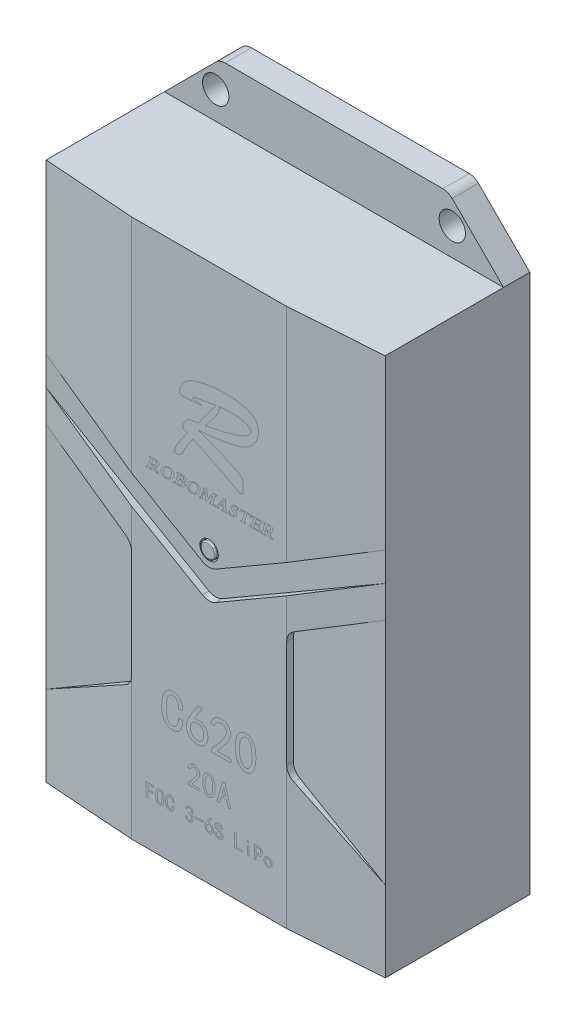
from build123d import *

# Parameters (mm, degrees)
SKETCH_1_W          = 25.8
SKETCH_1_H          = 49.4
EXTRUDE_1_DEPTH     = 11.5
SKETCH_2_W          = 65.082763186
SKETCH_2_H          = 29.72436647
SKETCH_2_W_2        = 74.485765389
SKETCH_2_H_2        = 30.540329471
CUT_EXTRUDE_1_DEPTH = 9.5
SKETCH_3_R          = 1
CUT_EXTRUDE_3_DEPTH = 11.5
CUT_EXTRUDE_4_DEPTH = 11.5
CUT_EXTRUDE_5_DEPTH = 62.5
SKETCH_6_R          = 0.7
CUT_EXTRUDE_6_DEPTH = 1
SKETCH_7_R          = 0.6
EXTRUDE_2_DEPTH     = 1.1
FILLET_1_R          = 0.1
CUT_EXTRUDE_7_DEPTH = 0.5
CUT_EXTRUDE_8_DEPTH = 0.5
FILLET_2_R          = 1
FILLET_3_R          = 1
FILLET_4_R          = 1


with BuildPart() as part:
    # 草图1 → 凸台-拉伸1 (new body)
    with BuildSketch(Plane.XY):
        Rectangle(SKETCH_1_W, SKETCH_1_H)
    extrude(amount=EXTRUDE_1_DEPTH)

    # 草图2 → 切除-拉伸1 (cut)
    with BuildSketch(Plane.XY.offset(11.5)):
        with Locations((5.938113154, 35.362183235)):
            Rectangle(SKETCH_2_W, SKETCH_2_H)
        with Locations((7.608894538, -35.770164736)):
            Rectangle(SKETCH_2_W_2, SKETCH_2_H_2)
    extrude(amount=-CUT_EXTRUDE_1_DEPTH, mode=Mode.SUBTRACT)

    # 草图3 → 切除-拉伸3 (cut)
    with BuildSketch(Plane.XY.offset(11.5)):
        with Locations((9, -22.6)):
            Circle(SKETCH_3_R)
        with Locations((-9, -22.6)):
            Circle(SKETCH_3_R)
        with Locations((-9, 22.6)):
            Circle(SKETCH_3_R)
        with Locations((9, 22.6)):
            Circle(SKETCH_3_R)
    extrude(amount=-CUT_EXTRUDE_3_DEPTH, mode=Mode.SUBTRACT)

    # 草图4 → 切除-拉伸4 (cut)
    with BuildSketch(Plane.XY.offset(2)):
        Polygon((8.7, 24.7), (12.9, 20.5), (12.9, 24.7), align=None)
        Polygon((-8.7, 24.7), (-12.9, 20.5), (-12.9, 24.7), align=None)
        Polygon((-12.9, -24.7), (-12.9, -20.5), (-8.7, -24.7), align=None)
        Polygon((12.9, -24.7), (8.7, -24.7), (12.9, -20.5), align=None)
    extrude(amount=-CUT_EXTRUDE_4_DEPTH, mode=Mode.SUBTRACT)

    # 草图5 → 切除-拉伸5 (cut)
    with BuildSketch(Plane.XZ.offset(20.5)):
        Polygon((5.9, 11.5), (12.9, 11), (12.9, 11.5), align=None)
        Polygon((-12.9, 11), (-12.9, 11.5), (-5.9, 11.5), align=None)
    extrude(amount=-CUT_EXTRUDE_5_DEPTH, mode=Mode.SUBTRACT)

    # 草图6 → 切除-拉伸6 (cut)
    with BuildSketch(Plane.XY.offset(11.5)):
        with Locations((0, 1.5)):
            Circle(SKETCH_6_R)
    extrude(amount=-CUT_EXTRUDE_6_DEPTH, mode=Mode.SUBTRACT)

    # 草图8 → 切除-拉伸7 (cut)
    with BuildSketch(Plane.XY.offset(11.5)):
        Polygon((0, 0.2), (12.9, 7.7), (12.9, 5.5), (0, -2), (-12.9, 5.5), (-12.9, 7.7), align=None)
    extrude(amount=-CUT_EXTRUDE_7_DEPTH, mode=Mode.SUBTRACT)

    # 草图9 → 切除-拉伸8 (cut)
    with BuildSketch(Plane.XY.offset(11.5)):
        with BuildLine():
            Line((6.397379543, -0.709722893), (12.9, 3.070870396))
            Line((12.9, 3.070870396), (12.9, -14.368664488))
            Line((12.9, -14.368664488), (6.397379543, -10.588071198))
            ThreePointArc((6.397379543, -10.588071198), (6.033218465, -10.222252062), (5.9, -9.723564012))
            Line((5.9, -9.723564012), (5.9, -1.57423008))
            ThreePointArc((5.9, -1.57423008), (6.033218465, -1.07554203), (6.397379543, -0.709722893))
        make_face()
        with BuildLine():
            Line((-5.9, -1.57423008), (-5.9, -9.723564012))
            ThreePointArc((-5.9, -9.723564012), (-6.033218465, -10.222252062), (-6.397379543, -10.588071198))
            Line((-6.397379543, -10.588071198), (-12.9, -14.368664488))
            Line((-12.9, -14.368664488), (-12.9, 3.070870396))
            Line((-12.9, 3.070870396), (-6.397379543, -0.709722893))
            ThreePointArc((-6.397379543, -0.709722893), (-6.033218465, -1.07554203), (-5.9, -1.57423008))
        make_face()
    extrude(amount=-CUT_EXTRUDE_8_DEPTH, mode=Mode.SUBTRACT)

    # 圆角2
    fillet_2_edges = [part.edges().sort_by_distance(p)[0] for p in [
        (0, -2, 11.25),
        (0, 0.2, 11.25),
    ]]
    fillet(fillet_2_edges, radius=FILLET_2_R)

    # 圆角3
    fillet_3_edges = [part.edges().sort_by_distance(p)[0] for p in [
        (8.7, -24.7, 1),
        (-8.7, -24.7, 1),
    ]]
    fillet(fillet_3_edges, radius=FILLET_3_R)

    # 圆角4
    fillet_4_edges = [part.edges().sort_by_distance(p)[0] for p in [
        (8.7, 24.7, 1),
        (-8.7, 24.7, 1),
    ]]
    fillet(fillet_4_edges, radius=FILLET_4_R)


with BuildPart() as body_2:
    # 草图7 → 凸台-拉伸2 (new body)
    with BuildSketch(Plane.XY.offset(10.5)):
        with Locations((0, 1.5)):
            Circle(SKETCH_7_R)
    extrude(amount=EXTRUDE_2_DEPTH)

    # 圆角1
    fillet_1_edges = [body_2.edges().sort_by_distance(p)[0] for p in [
        (-0.6, 1.5, 11.6),
    ]]
    fillet(fillet_1_edges, radius=FILLET_1_R)


solid = Compound([part.part, body_2.part])
